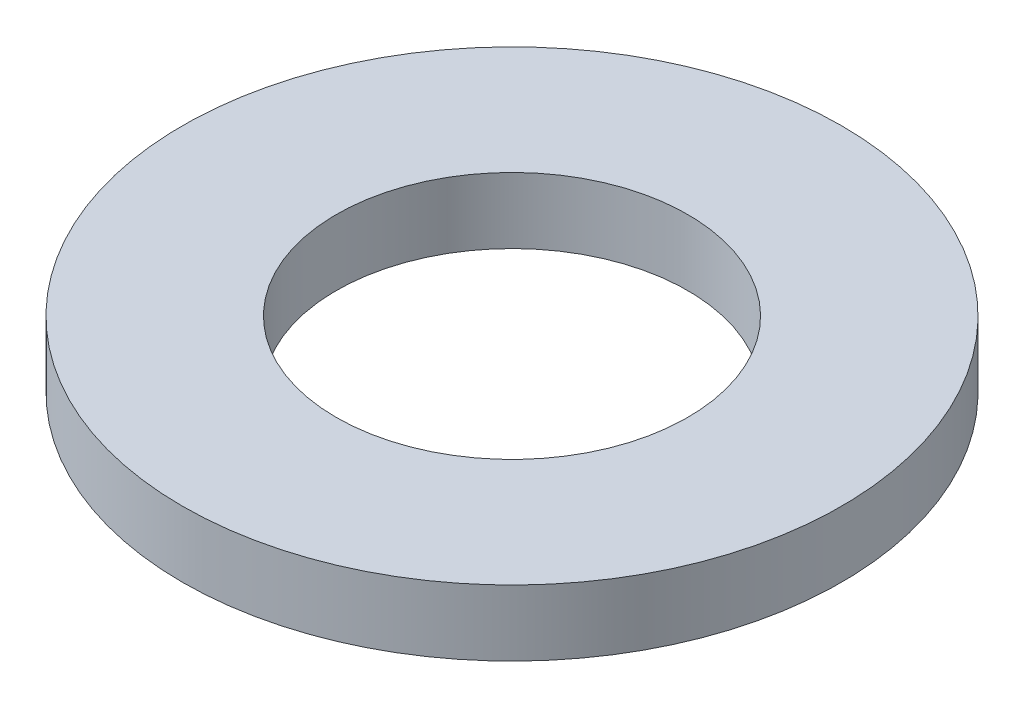
from build123d import *

# Parameters (mm, degrees)
SKETCH1_R           = 7.5
SKETCH1_R_2         = 4
BOSS_EXTRUDE1_DEPTH = 1.5


with BuildPart() as part:
    # Sketch1 → Boss-Extrude1 (new body)
    with BuildSketch(Plane(origin=(0, 0, 0), x_dir=(1, 0, 0), z_dir=(0, 1, 0))):
        with Locations(Location((0, 0, 0), (0, 0, 270))):
            Circle(SKETCH1_R)
        with Locations(Location((0, 0, 0), (0, 0, 270))):
            Circle(SKETCH1_R_2, mode=Mode.SUBTRACT)
    extrude(amount=BOSS_EXTRUDE1_DEPTH)


solid = part.part
